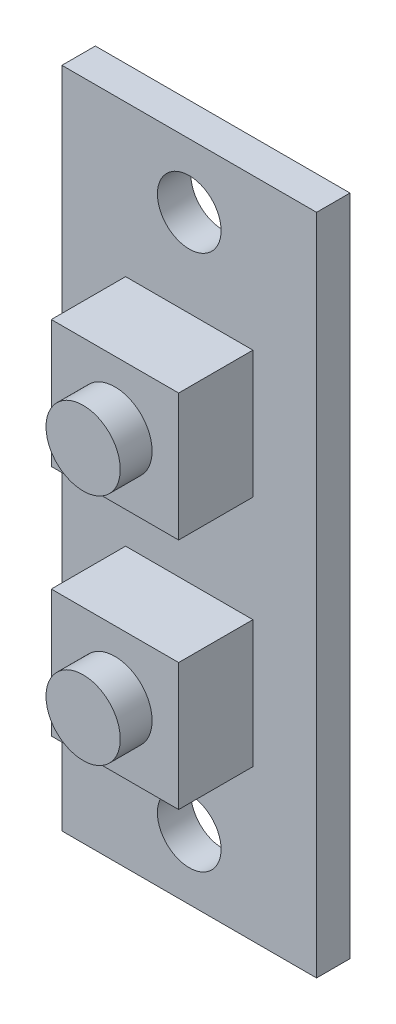
from build123d import *

# Parameters (mm, degrees)
SKETCH1_W               = 12.192
SKETCH1_H               = 31.75
BOSS_EXTRUDE1_DEPTH     = 1.6002
SKETCH2_W               = 6.096
SKETCH2_H               = 6.096
BOSS_EXTRUDE2_DEPTH     = 3.556
SKETCH3_R               = 1.778
BOSS_EXTRUDE3_DEPTH     = 1.524
CUT_EXTRUDE1_DEPTH      = 18.747767212
CUT_EXTRUDE1_DEPTH_BACK = 18.747767212
SKETCH4_R               = 1.524


with BuildPart() as part:
    # Sketch1 → Boss-Extrude1 (new body)
    with BuildSketch(Plane.XY):
        Rectangle(SKETCH1_W, SKETCH1_H)
    extrude(amount=BOSS_EXTRUDE1_DEPTH)

    # Sketch2 → Boss-Extrude2 (add)
    with BuildSketch(Plane.XY.offset(1.6002)):
        with Locations((0, 5.588)):
            Rectangle(SKETCH2_W, SKETCH2_H)
        with Locations((0, -5.588)):
            Rectangle(SKETCH2_W, SKETCH2_H)
    extrude(amount=BOSS_EXTRUDE2_DEPTH)

    # Sketch3 → Boss-Extrude3 (add)
    with BuildSketch(Plane.XY.offset(5.1562)):
        with Locations(Location((0, 5.588, 0), (0, 0, 180))):
            Circle(SKETCH3_R)
        with Locations(Location((0, -5.588, 0), (0, 0, 180))):
            Circle(SKETCH3_R)
    extrude(amount=BOSS_EXTRUDE3_DEPTH)

    # Sketch4 → Cut-Extrude1 (cut, two sides: drawn at the far end of the back side and taken through both)
    with BuildSketch(Plane.XY.offset(1.6002).offset(-CUT_EXTRUDE1_DEPTH_BACK)):
        with Locations((0, 12.827)):
            Circle(SKETCH4_R)
        with Locations((0, -12.827)):
            Circle(SKETCH4_R)
    extrude(amount=CUT_EXTRUDE1_DEPTH + CUT_EXTRUDE1_DEPTH_BACK, mode=Mode.SUBTRACT)


solid = part.part
